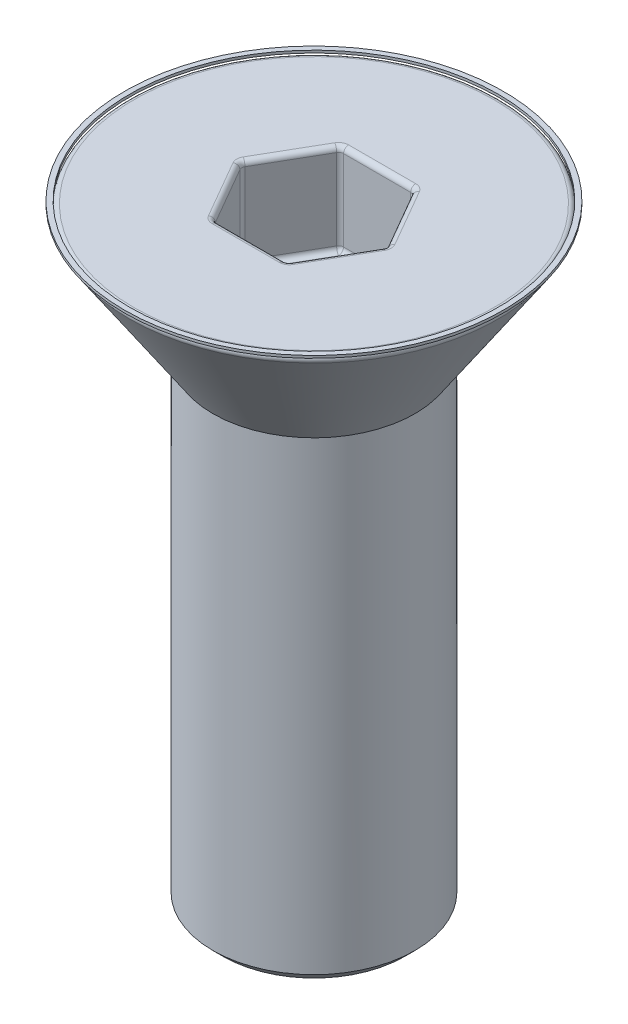
from build123d import *

# Parameters (mm, degrees)
CUT_EXTRUDE1_DEPTH = 1.8
CHAMFER1_SIZE      = 0.2
FILLET1_R          = 0.1
SKETCH_1_R         = 3.75
SKETCH_1_R_2       = 3.65
EXTRUDE_1920_DEPTH = 0.05


with BuildPart() as part:
    # Sketch1 → Revolve1 (revolve)
    with BuildSketch(Plane(origin=(0, 0, 0), x_dir=(0, 0, -1), z_dir=(1, 0, 0))):
        Polygon((-3.75, 2.6), (-2, 0), (-2, -9.4), (0, -9.4), (0, 2.6), align=None)
    revolve(axis=Axis((0, 2.6, 0), (0, -1, 0)))

    # Sketch2 → Cut-Extrude1 (cut)
    with BuildSketch(Plane(origin=(0, 2.6, 0), x_dir=(1, 0, 0), z_dir=(0, 1, 0))):
        Polygon((1.443375673, 0), (0.721687836, 1.25), (-0.721687836, 1.25), (-1.443375673, 0), (-0.721687836, -1.25), (0.721687836, -1.25), align=None)
    extrude(amount=-CUT_EXTRUDE1_DEPTH, mode=Mode.SUBTRACT)

    # Chamfer1
    chamfer1_edges = [part.edges().sort_by_distance(p)[0] for p in [
        (0, -9.4, -2),
    ]]
    chamfer(chamfer1_edges, length=CHAMFER1_SIZE)

    # Fillet1
    fillet1_edges = [part.edges().sort_by_distance(p)[0] for p in [
        (1.082531755, 0.8, 0.625),
        (1.443375673, 1.7, 0),
        (0, 0.8, 1.25),
        (0.721687836, 1.7, 1.25),
        (-1.082531755, 0.8, 0.625),
        (-0.721687836, 1.7, 1.25),
        (-1.082531755, 0.8, -0.625),
        (-1.443375673, 1.7, 0),
        (0, 0.8, -1.25),
        (-0.721687836, 1.7, -1.25),
        (1.082531755, 0.8, -0.625),
        (0.721687836, 1.7, -1.25),
        (1.082531755, 2.6, 0.625),
        (1.082531755, 2.6, -0.625),
        (0, 2.6, -1.25),
        (-1.082531755, 2.6, -0.625),
        (-1.082531755, 2.6, 0.625),
        (0, 2.6, 1.25),
        (0, 2.6, -3.75),
    ]]
    fillet(fillet1_edges, radius=FILLET1_R)


with BuildPart() as body_2:
    # 草图1 → Extrude 1920 (new body)
    with BuildSketch(Plane(origin=(0, 2.6, 0), x_dir=(1, 0, 0), z_dir=(0, 1, 0))):
        with Locations(Location((0, 0, 0), (0, 0, 270))):
            Circle(SKETCH_1_R)
        with Locations(Location((0, 0, 0), (0, 0, 270))):
            Circle(SKETCH_1_R_2, mode=Mode.SUBTRACT)
    extrude(amount=EXTRUDE_1920_DEPTH)


solid = Compound([part.part, body_2.part])
